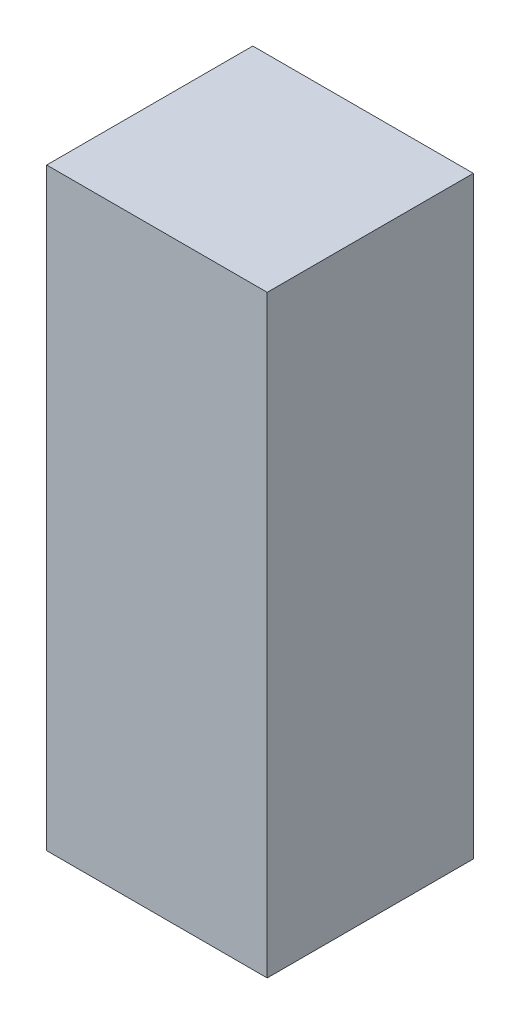
from build123d import *

# Parameters (mm, degrees)
SKETCH1_W           = 20.5
SKETCH1_H           = 19.16
BOSS_EXTRUDE1_DEPTH = 55.2


with BuildPart() as part:
    # Sketch1 → Boss-Extrude1 (new body)
    with BuildSketch(Plane(origin=(0, 0, 0), x_dir=(1, 0, 0), z_dir=(0, 1, 0))):
        Rectangle(SKETCH1_W, SKETCH1_H)
    extrude(amount=-BOSS_EXTRUDE1_DEPTH)


solid = part.part
